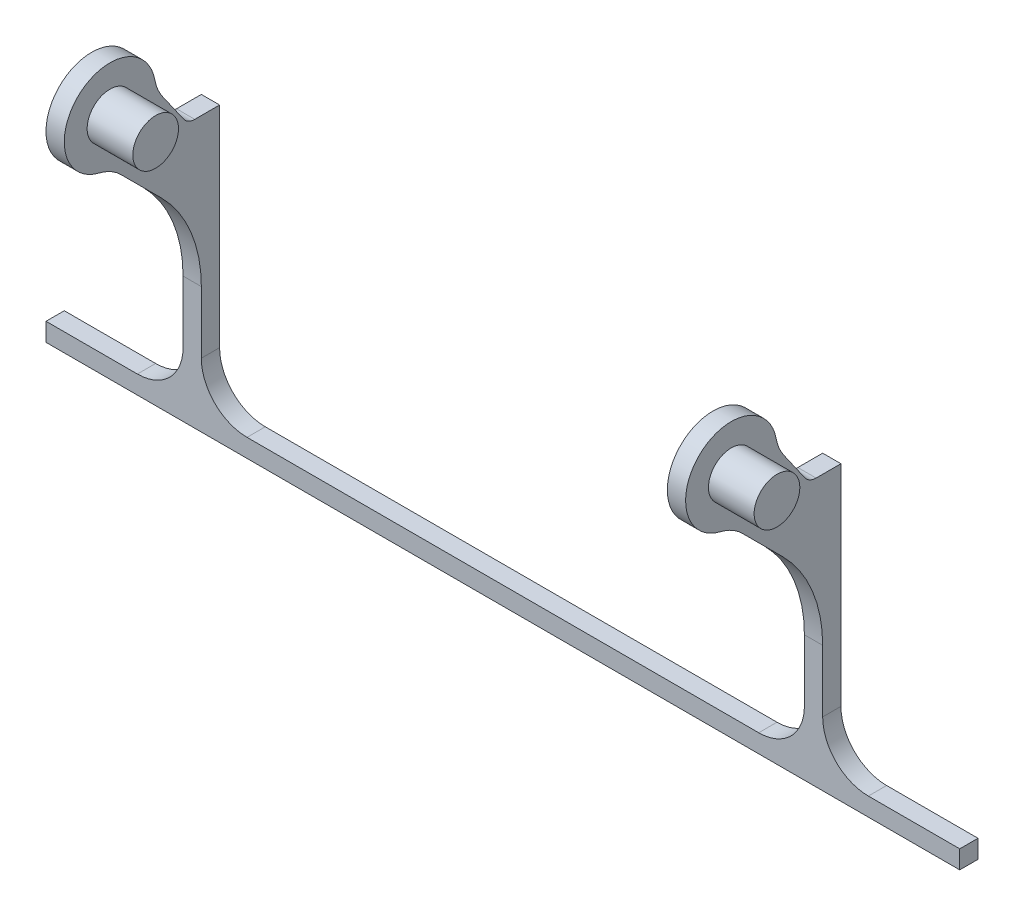
from build123d import *

# Parameters (mm, degrees)
BOSS_EXTRU_1_DEPTH = 4
BOSS_EXTRU_2_DEPTH = 4
BOSS_EXTRU_3_START = -4
BOSS_EXTRU_3_DEPTH = 4
CONG_1_R           = 30
CONG_2_R           = 30
CONG_3_R           = 10
BOSS_EXTRU_4_DEPTH = 4
BOSS_EXTRU_5_DEPTH = 4
ESQUISSE7_R        = 5
BOSS_EXTRU_6_DEPTH = 10
ESQUISSE9_R        = 5
BOSS_EXTRU_7_DEPTH = 14
CONG_4_R           = 10
CONG_5_R           = 3


with BuildPart() as part:
    # Esquisse1 → Boss.-Extru.1 (new body)
    with BuildSketch(Plane.XY):
        Polygon((-70, -110), (-66, -110), (-66, -156), (66, -156), (66, -110), (70, -110), (70, -156), (100, -156), (100, -160), (-100, -160), (-100, -156), (-70, -156), align=None)
    extrude(amount=-BOSS_EXTRU_1_DEPTH)

    # Esquisse2 → Boss.-Extru.2 (add)
    with BuildSketch(Plane(origin=(70, 0, 0), x_dir=(0, 0, -1), z_dir=(1, 0, 0))):
        with BuildLine():
            Line((0, -120), (-20, -100))
            ThreePointArc((-20, -100), (-27.071067812, -82.928932188), (-10, -90))
            Line((-10, -90), (4, -110))
            Line((4, -110), (0, -110))
            Line((0, -110), (0, -120))
        make_face()
    extrude(amount=-BOSS_EXTRU_2_DEPTH)

    # Esquisse3 → Boss.-Extru.3 (add)
    with BuildSketch(Plane.ZY.offset(70).offset(BOSS_EXTRU_3_START)):
        with BuildLine():
            Line((-4, -110), (10, -90))
            ThreePointArc((10, -90), (27.071067812, -82.928932188), (20, -100))
            Line((20, -100), (0, -120))
            Line((0, -120), (0, -110))
            Line((0, -110), (-4, -110))
        make_face()
    extrude(amount=BOSS_EXTRU_3_DEPTH)

    # Congé1
    cong_1_edges = [part.edges().sort_by_distance(p)[0] for p in [
        (68, -120, 0),
        (-68, -120, 0),
    ]]
    fillet(cong_1_edges, radius=CONG_1_R)

    # Congé2
    cong_2_edges = [part.edges().sort_by_distance(p)[0] for p in [
        (68, -110, -4),
        (-68, -110, -4),
    ]]
    fillet(cong_2_edges, radius=CONG_2_R)

    # Congé3
    cong_3_edges = [part.edges().sort_by_distance(p)[0] for p in [
        (-70, -156, -2),
        (-66, -156, -2),
        (66, -156, -2),
        (70, -156, -2),
    ]]
    fillet(cong_3_edges, radius=CONG_3_R)

    # Esquisse4 → Boss.-Extru.4 (add)
    with BuildSketch(Plane.ZY.offset(70)):
        Polygon((-4, -119.456666925), (-4, -100), (3, -100), align=None)
    extrude(amount=-BOSS_EXTRU_4_DEPTH)

    # Esquisse6 → Boss.-Extru.5 (add)
    with BuildSketch(Plane(origin=(70, 0, 0), x_dir=(0, 0, -1), z_dir=(1, 0, 0))):
        Polygon((4, -119.456666925), (4, -100), (-3, -100), align=None)
    extrude(amount=-BOSS_EXTRU_5_DEPTH)

    # Esquisse7 → Boss.-Extru.6 (add)
    with BuildSketch(Plane(origin=(70, 0, 0), x_dir=(0, 0, -1), z_dir=(1, 0, 0))):
        with Locations(Location((-20, -90, 0), (0, 0, 90))):
            Circle(ESQUISSE7_R)
    extrude(amount=BOSS_EXTRU_6_DEPTH)

    # Esquisse9 → Boss.-Extru.7 (add)
    with BuildSketch(Plane.ZY.offset(70)):
        with Locations(Location((20, -90, 0), (0, 0, 90))):
            Circle(ESQUISSE9_R)
    extrude(amount=-BOSS_EXTRU_7_DEPTH)

    # Congé4
    cong_4_edges = [part.edges().sort_by_distance(p)[0] for p in [
        (68, -100, 20),
        (68, -90, 10),
        (-68, -90, 10),
        (-68, -100, 20),
    ]]
    fillet(cong_4_edges, radius=CONG_4_R)

    # Congé5
    cong_5_edges = [part.edges().sort_by_distance(p)[0] for p in [
        (-68, -100, 3),
        (68, -100, 3),
    ]]
    fillet(cong_5_edges, radius=CONG_5_R)


solid = part.part
